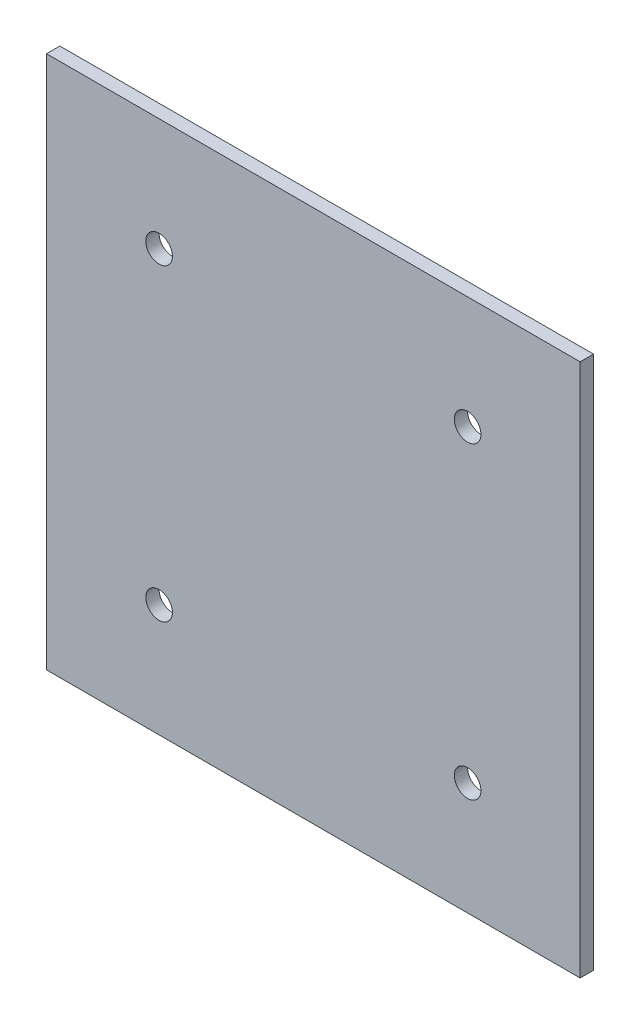
from build123d import *

# Parameters (mm, degrees)
PCB_1_6_START         = 8
SKETCH_1_W            = 64
SKETCH_1_H            = 64
PCB_1_6_DEPTH         = 1.6
CUT_EXTRUDE_START     = 8
SKETCH_2_R            = 1.6
CUT_EXTRUDE_451_DEPTH = 1.6


with BuildPart() as part:
    # 草图1 → PCB外廓参考_板厚暂按1.6 (new body)
    with BuildSketch(Plane.XY.offset(PCB_1_6_START)):
        Rectangle(SKETCH_1_W, SKETCH_1_H)
    extrude(amount=PCB_1_6_DEPTH)

    # 草图2 → Cut-Extrude 451 (cut)
    with BuildSketch(Plane.XY.offset(CUT_EXTRUDE_START)):
        with Locations((-18.5, -18.5)):
            Circle(SKETCH_2_R)
        with Locations((-18.5, 18.5)):
            Circle(SKETCH_2_R)
        with Locations((18.5, -18.5)):
            Circle(SKETCH_2_R)
        with Locations((18.5, 18.5)):
            Circle(SKETCH_2_R)
    extrude(amount=CUT_EXTRUDE_451_DEPTH, mode=Mode.SUBTRACT)


solid = part.part
